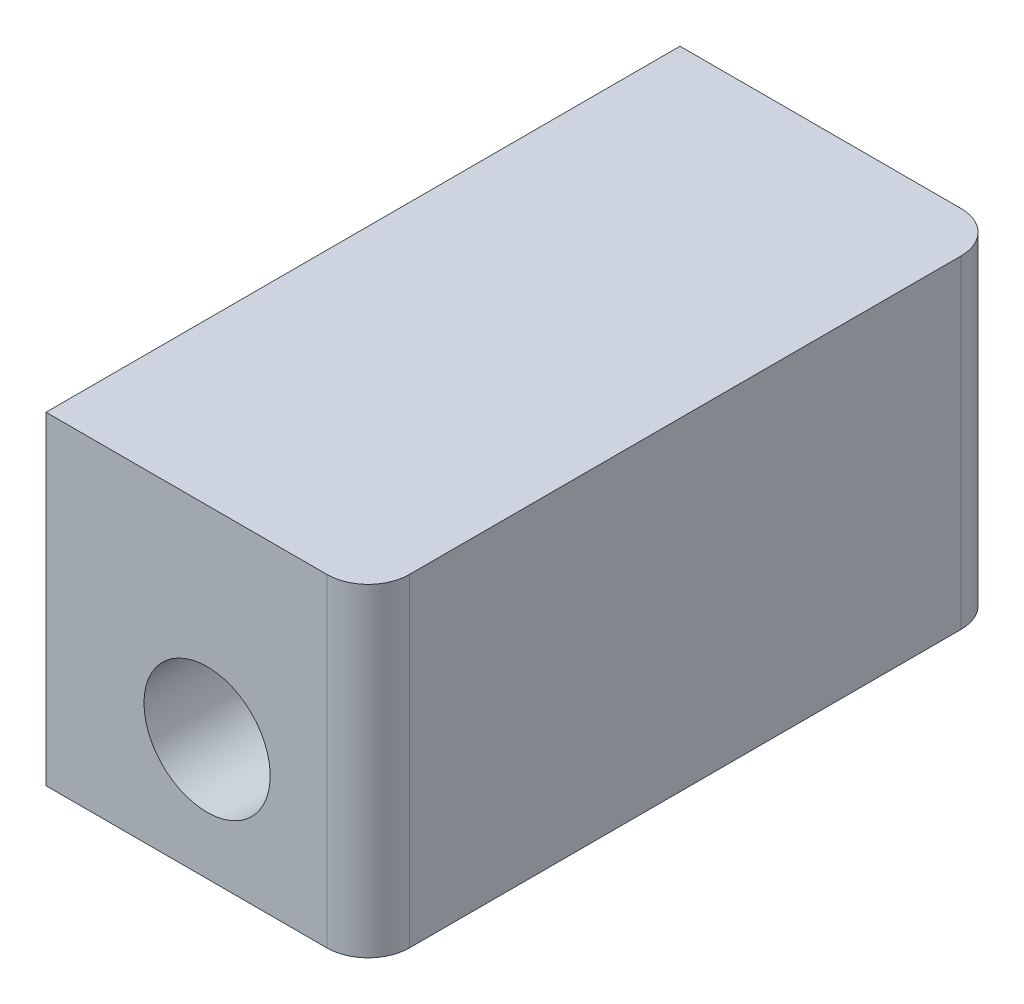
from build123d import *

# Parameters (mm, degrees)
SKETCH1_W           = 12.45
SKETCH1_H           = 24.5
BOSS_EXTRUDE1_DEPTH = 6.25
FILLET1_R           = 1.5875
SKETCH2_R           = 2.4384
CUT_EXTRUDE2_DEPTH  = 27.039645255


with BuildPart() as part:
    # Sketch1 → Boss-Extrude1 (new, symmetric)
    with BuildSketch(Plane(origin=(0, 0, 0), x_dir=(1, 0, 0), z_dir=(0, 1, 0))):
        Rectangle(SKETCH1_W, SKETCH1_H)
    extrude(amount=BOSS_EXTRUDE1_DEPTH, both=True)

    # Fillet1
    fillet1_edges = [part.edges().sort_by_distance(p)[0] for p in [
        (6.225, 0, 12.25),
        (6.225, 0, -12.25),
    ]]
    fillet(fillet1_edges, radius=FILLET1_R)

    # Sketch2 → Cut-Extrude2 (cut, through all)
    with BuildSketch(Plane(origin=(0, 0, -12.25), x_dir=(-1, 0, 0), z_dir=(0, 0, -1))):
        with Locations((0, -1.5875)):
            Circle(SKETCH2_R)
    extrude(amount=-CUT_EXTRUDE2_DEPTH, mode=Mode.SUBTRACT)


solid = part.part
